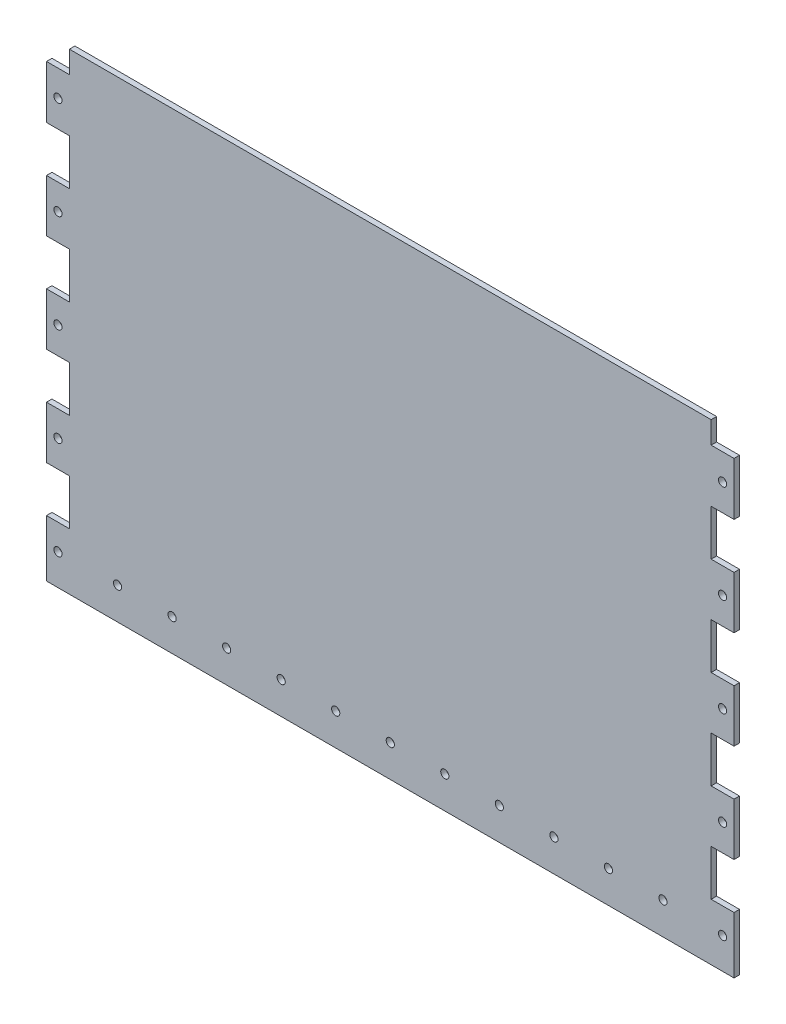
from build123d import *

# Parameters (mm, degrees)
SKETCH_1_W          = 252.1
SKETCH_1_H          = 166.2
EXTRUDE_1_DEPTH     = 1
SKETCH_2_R          = 1.5
SKETCH_2_W          = 8.4
SKETCH_2_H          = 16.8
SKETCH_2_W_2        = 252.1
SKETCH_2_H_2        = 0.2
SKETCH_2_H_3        = 1
CUT_EXTRUDE1_DEPTH  = 10
SKETCH1_R           = 1.5
CUT_EXTRUDE2_DEPTH  = 10
SKETCH2_W           = 235.3
SKETCH2_H           = 8.1
BOSS_EXTRUDE1_DEPTH = 2


with BuildPart() as part:
    # 草图1 → 凸台-拉伸1 (new, symmetric)
    with BuildSketch(Plane.XY):
        Rectangle(SKETCH_1_W, SKETCH_1_H)
    extrude(amount=EXTRUDE_1_DEPTH, both=True)

    # 草图2 → Cut-Extrude1 (cut)
    with BuildSketch(Plane.XY.offset(1)):
        with Locations((-121.85, 73.3)):
            Circle(SKETCH_2_R)
        with Locations((-121.85, 37.3)):
            Circle(SKETCH_2_R)
        with Locations((-121.85, 1.3)):
            Circle(SKETCH_2_R)
        with Locations((-121.85, -34.7)):
            Circle(SKETCH_2_R)
        with Locations((-121.85, -70.7)):
            Circle(SKETCH_2_R)
        with Locations((121.85, -70.7)):
            Circle(SKETCH_2_R)
        with Locations((121.85, -34.7)):
            Circle(SKETCH_2_R)
        with Locations((121.85, 1.3)):
            Circle(SKETCH_2_R)
        with Locations((121.85, 37.3)):
            Circle(SKETCH_2_R)
        with Locations((121.85, 73.3)):
            Circle(SKETCH_2_R)
        with Locations((-121.85, 55.1)):
            Rectangle(SKETCH_2_W, SKETCH_2_H)
        with Locations((-121.85, 19.1)):
            Rectangle(SKETCH_2_W, SKETCH_2_H)
        with Locations((-121.85, -16.9)):
            Rectangle(SKETCH_2_W, SKETCH_2_H)
        with Locations((-121.85, -52.9)):
            Rectangle(SKETCH_2_W, SKETCH_2_H)
        with Locations((121.85, -52.9)):
            Rectangle(SKETCH_2_W, SKETCH_2_H)
        with Locations((121.85, -16.9)):
            Rectangle(SKETCH_2_W, SKETCH_2_H)
        with Locations((121.85, 19.1)):
            Rectangle(SKETCH_2_W, SKETCH_2_H)
        with Locations((121.85, 55.1)):
            Rectangle(SKETCH_2_W, SKETCH_2_H)
        with Locations((0, 83)):
            Rectangle(SKETCH_2_W_2, SKETCH_2_H_2)
        with Locations((0, -82.6)):
            Rectangle(SKETCH_2_W_2, SKETCH_2_H_3)
    extrude(amount=-CUT_EXTRUDE1_DEPTH, mode=Mode.SUBTRACT)

    # Sketch1 → Cut-Extrude2 (cut)
    with BuildSketch(Plane.XY.offset(1)):
        with Locations((100, -70.35)):
            Circle(SKETCH1_R)
        with Locations((80, -70.35)):
            Circle(SKETCH1_R)
        with Locations((60, -70.35)):
            Circle(SKETCH1_R)
        with Locations((40, -70.35)):
            Circle(SKETCH1_R)
        with Locations((20, -70.35)):
            Circle(SKETCH1_R)
        with Locations((0, -70.35)):
            Circle(SKETCH1_R)
        with Locations((-20, -70.35)):
            Circle(SKETCH1_R)
        with Locations((-40, -70.35)):
            Circle(SKETCH1_R)
        with Locations((-60, -70.35)):
            Circle(SKETCH1_R)
        with Locations((-80, -70.35)):
            Circle(SKETCH1_R)
        with Locations((-100, -70.35)):
            Circle(SKETCH1_R)
    extrude(amount=-CUT_EXTRUDE2_DEPTH, mode=Mode.SUBTRACT)

    # Sketch2 → Boss-Extrude1 (add)
    with BuildSketch(Plane.XY.offset(1)):
        with Locations((0, 86.95)):
            Rectangle(SKETCH2_W, SKETCH2_H)
    extrude(amount=-BOSS_EXTRUDE1_DEPTH)


solid = part.part
